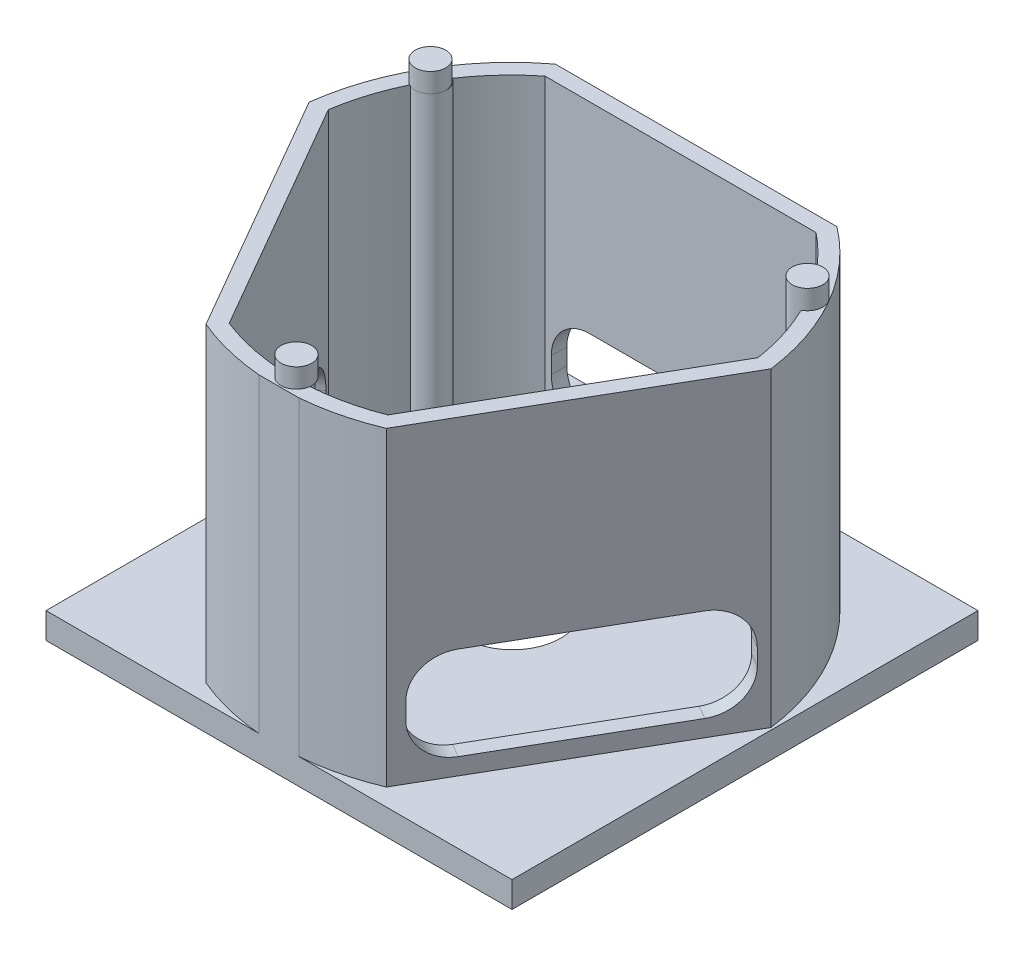
from build123d import *

# Parameters (mm, degrees)
SKETCH1_W                = 152.4
SKETCH1_H                = 152.4
BOSS_EXTRUDE1_DEPTH      = 8.466666667
BOSS_EXTRUDE3_DEPTH      = 101.6
SKETCH4_R                = 5.006944118
BOSS_EXTRUDE4_DEPTH      = 6.35
CUT_EXTRUDE1_REACH       = 205.785
SKETCH6_W                = 84.1375
SKETCH6_H                = 30.46777391
FILLET1_R                = 12.54
CIRPATTERN3_COUNT        = 3
FILLET1_OF_CIRPATTERN3_R = 12.54
SKETCH8_R                = 3.175
CUT_EXTRUDE2_DEPTH       = 6.35
SKETCH9_R                = 15.793040305
CUT_EXTRUDE4_DEPTH       = 153.593412515


with BuildPart() as part:
    # Sketch1 → Boss-Extrude1 (new body)
    with BuildSketch(Plane(origin=(0, 0, 0), x_dir=(1, 0, 0), z_dir=(0, 1, 0))):
        with Locations((0, -0.122388871)):
            Rectangle(SKETCH1_W, SKETCH1_H)
    extrude(amount=BOSS_EXTRUDE1_DEPTH)

    # Sketch3 → Boss-Extrude3 (add)
    with BuildSketch(Plane(origin=(0, 8.466666667, 0), x_dir=(1, 0, 0), z_dir=(0, 1, 0))):
        with BuildLine():
            ThreePointArc((-58.918716059, 39.286110084), (-65.909577408, 37.544355622), (-63.922550345, 30.619214868))
            ThreePointArc((-63.922550345, 30.619214868), (-61.573436607, 35.040883563), (-58.918716059, 39.286110084))
        make_face()
        with BuildLine():
            ThreePointArc((-58.918716059, 39.286110084), (-61.573436607, 35.040883563), (-63.922550345, 30.619214868))
            ThreePointArc((-63.922550345, 30.619214868), (-58.993939739, 30.749533507), (-56.566492489, 35.040883563))
            ThreePointArc((-56.566492489, 35.040883563), (-57.193851762, 37.467553294), (-58.918716059, 39.286110084))
        make_face()
        with BuildLine():
            Line((45.987944587, 60.142290401), (-46.087055413, 60.142290401))
            ThreePointArc((-46.087055413, 60.142290401), (-65.972845658, 37.580883563), (-75.568702003, 9.078580617))
            Line((-75.568702003, 9.078580617), (-29.531202003, -70.660708437))
            ThreePointArc((-29.531202003, -70.660708437), (-18.268592558, -74.38917131), (-6.563445111, -76.322388871))
            Line((-6.563445111, -76.322388871), (-1.471511547, -76.322388871))
            ThreePointArc((-1.471511547, -76.322388871), (-4.113530257, -74.446258004), (-5.053389698, -71.345162371))
            ThreePointArc((-5.053389698, -71.345162371), (-15.708360105, -69.77438362), (-26.003436632, -66.610977296))
            Line((-26.003436632, -66.610977296), (-70.297649271, 10.108849476))
            ThreePointArc((-70.297649271, 10.108849476), (-67.889701246, 20.606350444), (-63.922550345, 30.619214868))
            ThreePointArc((-63.922550345, 30.619214868), (-65.909577408, 37.544355622), (-58.918716059, 39.286110084))
            ThreePointArc((-58.918716059, 39.286110084), (-52.230896554, 47.728195757), (-44.343768052, 55.062290401))
            Line((-44.343768052, 55.062290401), (44.244657227, 55.062290401))
            ThreePointArc((44.244657227, 55.062290401), (52.131785728, 47.728195757), (58.819605234, 39.286110084))
            ThreePointArc((58.819605234, 39.286110084), (63.900995513, 39.420468408), (66.481269899, 35.040883563))
            ThreePointArc((66.481269899, 35.040883563), (65.765675838, 32.461386695), (63.823439519, 30.619214868))
            ThreePointArc((63.823439519, 30.619214868), (67.790590421, 20.606350444), (70.198538446, 10.108849476))
            Line((70.198538446, 10.108849476), (25.904325806, -66.610977296))
            ThreePointArc((25.904325806, -66.610977296), (15.60924928, -69.77438362), (4.954278873, -71.345162371))
            ThreePointArc((4.954278873, -71.345162371), (4.956611187, -71.433369756), (4.957388705, -71.521604544))
            ThreePointArc((4.957388705, -71.521604544), (3.962248689, -74.517421169), (1.372400721, -76.322388871))
            Line((1.372400721, -76.322388871), (6.464334286, -76.322388871))
            ThreePointArc((6.464334286, -76.322388871), (18.169481733, -74.38917131), (29.432091177, -70.660708437))
            Line((29.432091177, -70.660708437), (75.469591177, 9.078580617))
            ThreePointArc((75.469591177, 9.078580617), (65.873734833, 37.580883563), (45.987944587, 60.142290401))
        make_face()
        with BuildLine():
            ThreePointArc((4.954278873, -71.345162371), (-0.049555413, -66.514660427), (-5.053389698, -71.345162371))
            ThreePointArc((-5.053389698, -71.345162371), (-0.049555413, -71.521604544), (4.954278873, -71.345162371))
        make_face()
        with BuildLine():
            ThreePointArc((-5.053389698, -71.345162371), (-4.113530257, -74.446258004), (-1.471511547, -76.322388871))
            Line((-1.471511547, -76.322388871), (1.372400721, -76.322388871))
            ThreePointArc((1.372400721, -76.322388871), (3.962248689, -74.517421169), (4.957388705, -71.521604544))
            ThreePointArc((4.957388705, -71.521604544), (4.956611187, -71.433369756), (4.954278873, -71.345162371))
            ThreePointArc((4.954278873, -71.345162371), (-0.049555413, -71.521604544), (-5.053389698, -71.345162371))
        make_face()
        with BuildLine():
            ThreePointArc((58.819605234, 39.286110084), (57.13818498, 32.537411504), (63.823439519, 30.619214868))
            ThreePointArc((63.823439519, 30.619214868), (61.474325782, 35.040883563), (58.819605234, 39.286110084))
        make_face()
        with BuildLine():
            ThreePointArc((58.819605234, 39.286110084), (61.474325782, 35.040883563), (63.823439519, 30.619214868))
            ThreePointArc((63.823439519, 30.619214868), (65.765675838, 32.461386695), (66.481269899, 35.040883563))
            ThreePointArc((66.481269899, 35.040883563), (63.900995513, 39.420468408), (58.819605234, 39.286110084))
        make_face()
    extrude(amount=BOSS_EXTRUDE3_DEPTH)

    # Sketch4 → Boss-Extrude4 (add)
    with BuildSketch(Plane(origin=(0, 110.066666667, 0), x_dir=(1, 0, 0), z_dir=(0, 1, 0))):
        with Locations(Location((61.474325782, 35.040883563, 0), (0, 0, 122.019492362))):
            Circle(SKETCH4_R)
        with Locations(Location((0.128367161, -70.759732709, 0), (0, 0, 171.336111326))):
            Circle(SKETCH4_R)
        with Locations(Location((-61.601057978, 34.817609153, 0), (0, 0, 354.23508657))):
            Circle(SKETCH4_R)
    extrude(amount=BOSS_EXTRUDE4_DEPTH)

    # Sketch6 → Cut-Extrude1 (cut, up to next)
    with BuildSketch(Plane(origin=(-52.74538578, 0, 30.452562679), x_dir=(0.5, 0, 0.8660254037844386), z_dir=(-0.8660254037844387, 0, 0.5000000000000001)), mode=Mode.PRIVATE) as cut_extrude1_sk1:
        with Locations((0.269593494, 29.172106293)):
            Rectangle(SKETCH6_W, SKETCH6_H)
    cut_extrude1_tool1 = extrude(cut_extrude1_sk1.sketch, amount=-CUT_EXTRUDE1_REACH, mode=Mode.PRIVATE) & part.part
    cut_extrude1 = cut_extrude1_tool1.solids().sort_by_distance((-52.610589, 29.172106, 30.686037))[0]
    add(cut_extrude1, mode=Mode.SUBTRACT)

    # Fillet1
    fillet1_edges = [part.edges().sort_by_distance(p)[0] for p in [
        (-29.376509507, 44.405993248, 65.848643698),
        (-29.376509507, 13.938219338, 65.848643698),
        (-71.445259507, 13.938219338, -7.016568713),
        (-71.445259507, 44.405993248, -7.016568713),
    ]]
    fillet(fillet1_edges, radius=FILLET1_R)

    # CirPattern3: Cut-Extrude1; each copy of Cut-Extrude1 runs up to whatever stops it at its own place
    cirpattern3_before = part.part  # the part as the pattern finds it: every copy runs up to it
    cirpattern3_cut_extrude1_long = extrude(cut_extrude1_sk1.sketch, amount=-CUT_EXTRUDE1_REACH, mode=Mode.PRIVATE)
    cirpattern3_cut_extrude1_tool1 = cirpattern3_cut_extrude1_long.rotate(Axis((0, 0, 0), (0, 1, 0)), 1 * 360 / CIRPATTERN3_COUNT) & cirpattern3_before
    add(cirpattern3_cut_extrude1_tool1.solids().sort_by_distance((52.880182, 29.172106, 30.219088))[0], mode=Mode.SUBTRACT)
    cirpattern3_cut_extrude1_tool2 = cirpattern3_cut_extrude1_long.rotate(Axis((0, 0, 0), (0, 1, 0)), 2 * 360 / CIRPATTERN3_COUNT) & cirpattern3_before
    add(cirpattern3_cut_extrude1_tool2.solids().sort_by_distance((-0.269593, 29.172106, -60.905125))[0], mode=Mode.SUBTRACT)

    # Fillet1 of CirPattern3
    fillet1_of_cirpattern3_edges = [part.edges().sort_by_distance(p)[0] for p in [
        (71.714853001, 44.405993248, -7.483518341),
        (71.714853001, 13.938219338, -7.483518341),
        (29.646103001, 13.938219338, 65.38169407),
        (29.646103001, 44.405993248, 65.38169407),
        (-42.338343494, 44.405993248, -58.365125357),
        (-42.338343494, 13.938219338, -58.365125357),
        (41.799156506, 13.938219338, -58.365125357),
        (41.799156506, 44.405993248, -58.365125357),
    ]]
    fillet(fillet1_of_cirpattern3_edges, radius=FILLET1_OF_CIRPATTERN3_R)

    # Sketch8 → Cut-Extrude2 (cut)
    with BuildSketch(Plane(origin=(0, 0, 0), x_dir=(-1, 0, 0), z_dir=(0, -1, 0))):
        with Locations(Location((63.5, -38.222388871, 0), (0, 0, 90))):
            Circle(SKETCH8_R)
        with Locations(Location((38.1, -63.622388871, 0), (0, 0, 90))):
            Circle(SKETCH8_R)
        with Locations(Location((-63.5, -38.222388871, 0), (0, 0, 270))):
            Circle(SKETCH8_R)
        with Locations(Location((-38.1, -63.622388871, 0), (0, 0, 270))):
            Circle(SKETCH8_R)
        with Locations(Location((63.5, 37.977611129, 0), (0, 0, 90))):
            Circle(SKETCH8_R)
        with Locations(Location((38.1, 63.377611129, 0), (0, 0, 90))):
            Circle(SKETCH8_R)
        with Locations(Location((-38.1, 63.377611129, 0), (0, 0, 90))):
            Circle(SKETCH8_R)
        with Locations(Location((-63.5, 37.977611129, 0), (0, 0, 90))):
            Circle(SKETCH8_R)
    extrude(amount=-CUT_EXTRUDE2_DEPTH, mode=Mode.SUBTRACT)

    # Sketch9 → Cut-Extrude4 (cut, through all)
    with BuildSketch(Plane(origin=(0, 8.466666667, 0), x_dir=(1, 0, 0), z_dir=(0, 1, 0))):
        with Locations(Location((0, 0, 0), (0, 0, 270))):
            Circle(SKETCH9_R)
    extrude(amount=-CUT_EXTRUDE4_DEPTH, mode=Mode.SUBTRACT)


solid = part.part
